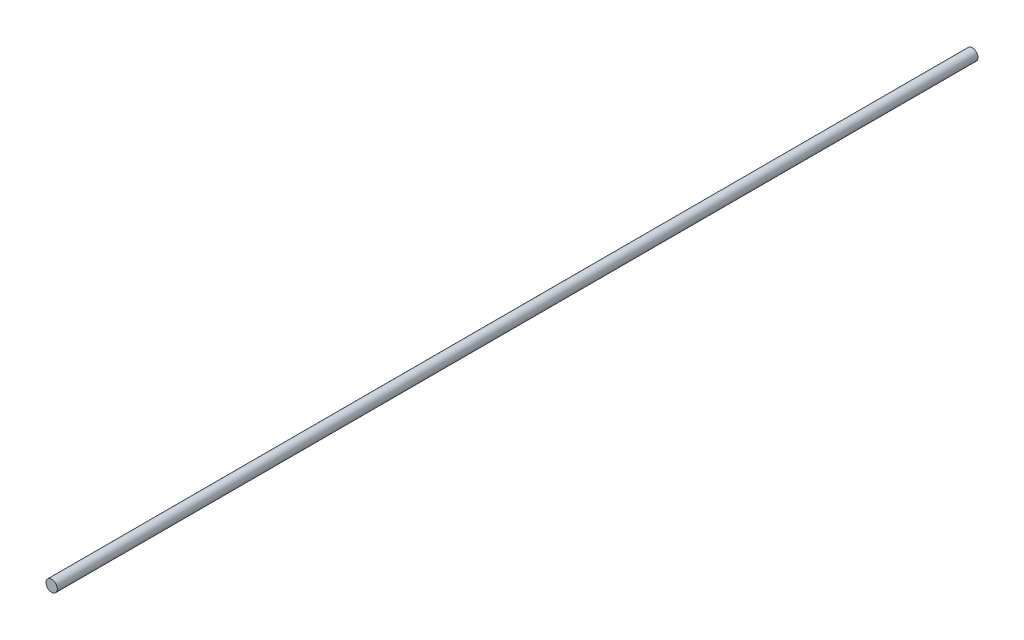
from build123d import *

# Parameters (mm, degrees)
SKETCH1_R           = 4
BOSS_EXTRUDE1_DEPTH = 325


with BuildPart() as part:
    # Sketch1 → Boss-Extrude1 (new, symmetric)
    with BuildSketch(Plane.XY):
        Circle(SKETCH1_R)
    extrude(amount=BOSS_EXTRUDE1_DEPTH, both=True)


solid = part.part
